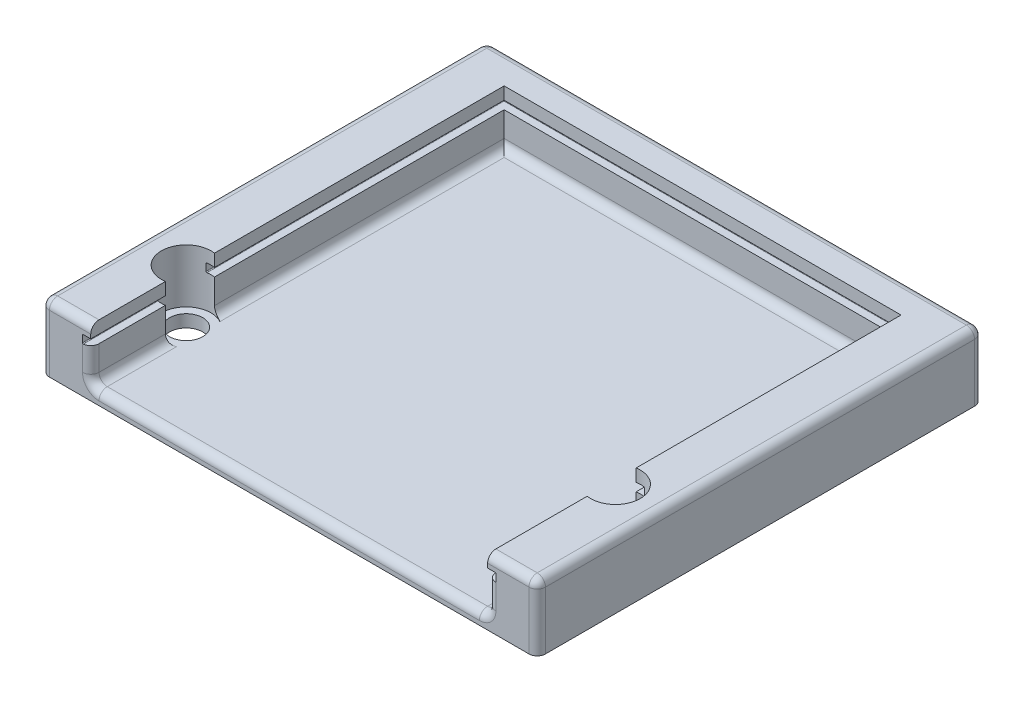
from build123d import *

# Parameters (mm, degrees)
BOSS_EXTRUDE1_DEPTH = 1.5
BOSS_EXTRUDE4_DEPTH = 8
SKETCH6_W           = 50
SKETCH6_H           = 1
CUT_EXTRUDE1_DEPTH  = 1
SKETCH10_W          = 50
SKETCH10_H          = 1
CUT_EXTRUDE2_DEPTH  = 1
SKETCH11_W          = 50
SKETCH11_H          = 1
CUT_EXTRUDE3_DEPTH  = 1
FILLET1_R           = 1
FILLET2_R           = 0.1


with BuildPart() as part:
    # Sketch2 → Boss-Extrude1 (new body)
    with BuildSketch(Plane(origin=(0, 0, 0), x_dir=(1, 0, 0), z_dir=(0, 1, 0))):
        with BuildLine():
            Line((6, 9.034557534), (6, 0))
            Line((6, 0), (54, 0))
            Line((54, 0), (54, 12.034557534))
            ThreePointArc((54, 12.034557534), (51.454038521, 15), (54, 17.965442466))
            Line((54, 17.965442466), (54, 50))
            Line((54, 50), (6, 50))
            Line((6, 50), (6, 14.965442466))
            ThreePointArc((6, 14.965442466), (7.822155184, 13.954211406), (8.545961479, 12))
            ThreePointArc((8.545961479, 12), (7.822155184, 10.045788594), (6, 9.034557534))
        make_face()
        with BuildLine():
            ThreePointArc((54, 17.965442466), (51.454038521, 15), (54, 12.034557534))
            Line((54, 12.034557534), (54, 13.052219463))
            ThreePointArc((54, 13.052219463), (52.454038521, 15), (54, 16.947780537))
            Line((54, 16.947780537), (54, 17.965442466))
        make_face()
        with BuildLine():
            Line((54, 13.052219463), (54, 12.034557534))
            ThreePointArc((54, 12.034557534), (56.408249927, 12.723806295), (57.454038521, 15))
            ThreePointArc((57.454038521, 15), (56.408249927, 17.276193705), (54, 17.965442466))
            Line((54, 17.965442466), (54, 16.947780537))
            ThreePointArc((54, 16.947780537), (55.697405514, 16.566537111), (56.454038521, 15))
            ThreePointArc((56.454038521, 15), (55.697405514, 13.433462889), (54, 13.052219463))
        make_face()
        with BuildLine():
            ThreePointArc((6, 14.965442466), (2.545961479, 12), (6, 9.034557534))
            Line((6, 9.034557534), (6, 10.052219463))
            ThreePointArc((6, 10.052219463), (3.545961479, 12), (6, 13.947780537))
            Line((6, 13.947780537), (6, 14.965442466))
        make_face()
        with BuildLine():
            Line((6, 10.052219463), (6, 9.034557534))
            ThreePointArc((6, 9.034557534), (7.822155184, 10.045788594), (8.545961479, 12))
            ThreePointArc((8.545961479, 12), (7.822155184, 13.954211406), (6, 14.965442466))
            Line((6, 14.965442466), (6, 13.947780537))
            ThreePointArc((6, 13.947780537), (7.11249859, 13.243366993), (7.545961479, 12))
            ThreePointArc((7.545961479, 12), (7.11249859, 10.756633007), (6, 10.052219463))
        make_face()
    extrude(amount=BOSS_EXTRUDE1_DEPTH)

    # Sketch2<7> → Boss-Extrude4 (add)
    with BuildSketch(Plane(origin=(0, 0, 0), x_dir=(1, 0, 0), z_dir=(0, 1, 0))):
        with BuildLine():
            Line((0, 0), (6, 0))
            Line((6, 0), (6, 9.034557534))
            ThreePointArc((6, 9.034557534), (2.545961479, 12), (6, 14.965442466))
            Line((6, 14.965442466), (6, 50))
            Line((6, 50), (54, 50))
            Line((54, 50), (54, 17.965442466))
            ThreePointArc((54, 17.965442466), (57.454038521, 15), (54, 12.034557534))
            Line((54, 12.034557534), (54, 0))
            Line((54, 0), (60, 0))
            Line((60, 0), (60, 53.896997513))
            Line((60, 53.896997513), (0, 53.896997513))
            Line((0, 53.896997513), (0, 0))
        make_face()
    extrude(amount=BOSS_EXTRUDE4_DEPTH)

    # Sketch6 → Cut-Extrude1 (cut)
    with BuildSketch(Plane(origin=(6, 0, 0), x_dir=(0, 0, -1), z_dir=(1, 0, 0))):
        with Locations((25, 6)):
            Rectangle(SKETCH6_W, SKETCH6_H)
    extrude(amount=-CUT_EXTRUDE1_DEPTH, mode=Mode.SUBTRACT)

    # Sketch10 → Cut-Extrude2 (cut)
    with BuildSketch(Plane.ZY.offset(-54)):
        with Locations((-25, 6)):
            Rectangle(SKETCH10_W, SKETCH10_H)
    extrude(amount=-CUT_EXTRUDE2_DEPTH, mode=Mode.SUBTRACT)

    # Sketch11 → Cut-Extrude3 (cut)
    with BuildSketch(Plane.XY.offset(-50)):
        with Locations((30, 6)):
            Rectangle(SKETCH11_W, SKETCH11_H)
    extrude(amount=-CUT_EXTRUDE3_DEPTH, mode=Mode.SUBTRACT)

    # Fillet1
    fillet1_edges = [part.edges().sort_by_distance(p)[0] for p in [
        (6, 1.5, -4.517278767),
        (6, 1.5, -32.482721233),
        (30, 1.5, -50),
        (54, 1.5, -33.982721233),
        (54, 1.5, -6.017278767),
        (30, 1.5, 0),
        (54, 3.5, 0),
        (6, 3.5, 0),
        (60, 4, -53.896997513),
        (0, 4, -53.896997513),
        (30, 8, -53.896997513),
        (0, 4, 0),
        (60, 4, 0),
        (60, 8, -26.948498756),
        (57, 8, 0),
        (3, 8, 0),
        (0, 8, -26.948498756),
    ]]
    fillet(fillet1_edges, radius=FILLET1_R)

    # Fillet2
    fillet2_edges = [part.edges().sort_by_distance(p)[0] for p in [
        (55, 6.5, -34.474951361),
        (55, 5.5, -6.025048639),
        (55, 6.5, -6.025048639),
        (55, 5.5, -34.474951361),
        (30, 6.5, -51),
        (30, 5.5, -51),
        (5, 6.5, -32.974951361),
        (5, 5.5, -4.525048639),
        (5, 6.5, -4.525048639),
        (5, 5.5, -32.974951361),
    ]]
    fillet(fillet2_edges, radius=FILLET2_R)


solid = part.part
